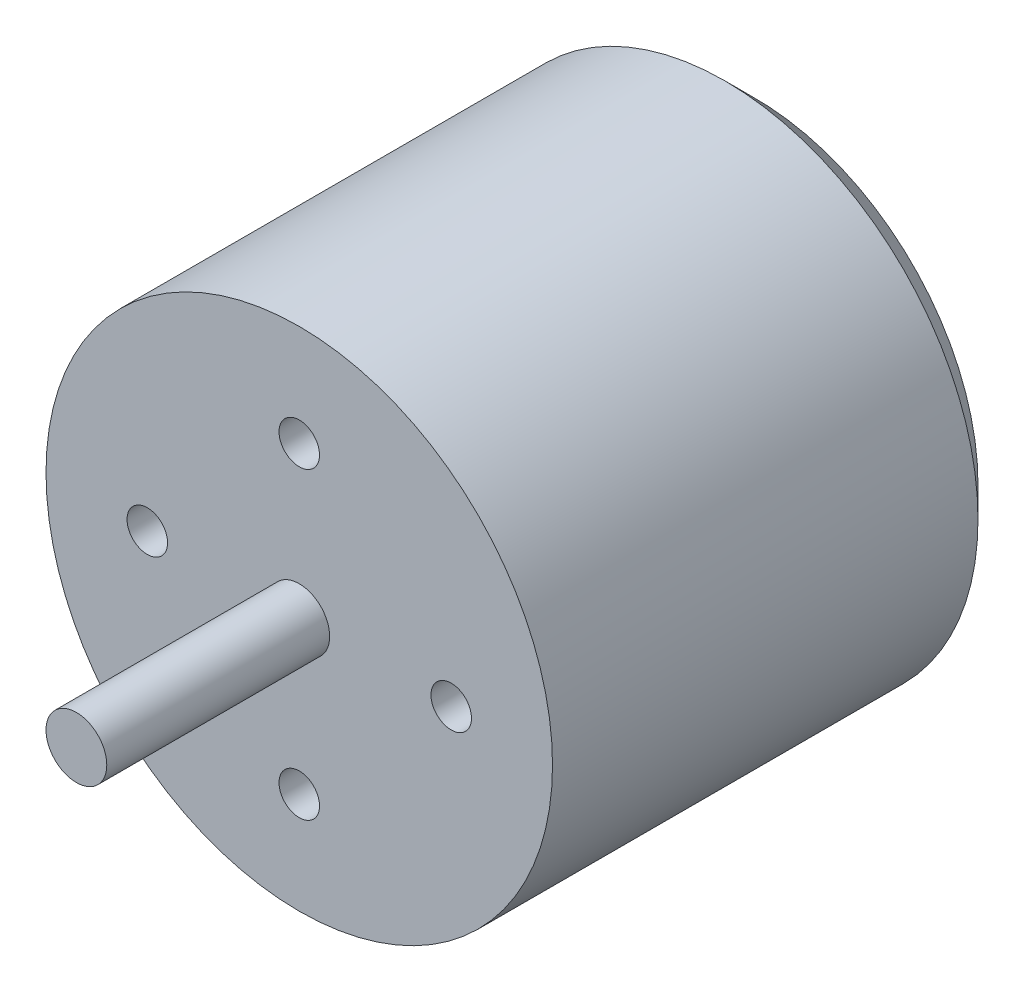
from build123d import *

# Parameters (mm, degrees)
SKETCH1_R           = 25
BOSS_EXTRUDE1_DEPTH = 45
SKETCH2_R           = 2
CUT_EXTRUDE1_DEPTH  = 10
SKETCH3_R           = 3
BOSS_EXTRUDE2_DEPTH = 22
SKETCH4_R           = 1.5
CUT_EXTRUDE2_DEPTH  = 10
BOSS_EXTRUDE3_START = 2
SKETCH5_R           = 3
BOSS_EXTRUDE3_DEPTH = 2
CHAMFER1_SIZE       = 3


with BuildPart() as part:
    # Sketch1 → Boss-Extrude1 (new body)
    with BuildSketch(Plane.XY):
        with Locations(Location((0, 0, 0), (0, 0, 180))):
            Circle(SKETCH1_R)
    extrude(amount=BOSS_EXTRUDE1_DEPTH)

    # Sketch2 → Cut-Extrude1 (cut)
    with BuildSketch(Plane.XY.offset(45)):
        with Locations((0, 15)):
            Circle(SKETCH2_R)
        with Locations(Location((0, -15, 0), (0, 0, 180))):
            Circle(SKETCH2_R)
        with Locations((-15, 0)):
            Circle(SKETCH2_R)
        with Locations(Location((15, 0, 0), (0, 0, 180))):
            Circle(SKETCH2_R)
    extrude(amount=-CUT_EXTRUDE1_DEPTH, mode=Mode.SUBTRACT)

    # Sketch3 → Boss-Extrude2 (add)
    with BuildSketch(Plane.XY.offset(45)):
        Circle(SKETCH3_R)
    extrude(amount=BOSS_EXTRUDE2_DEPTH)

    # Sketch4 → Cut-Extrude2 (cut)
    with BuildSketch(Plane(origin=(0, 0, 0), x_dir=(-1, 0, 0), z_dir=(0, 0, -1))):
        with Locations((0, 10)):
            Circle(SKETCH4_R)
        with Locations(Location((0, -10, 0), (0, 0, 180))):
            Circle(SKETCH4_R)
        with Locations((-10, 0)):
            Circle(SKETCH4_R)
        with Locations(Location((10, 0, 0), (0, 0, 180))):
            Circle(SKETCH4_R)
    extrude(amount=-CUT_EXTRUDE2_DEPTH, mode=Mode.SUBTRACT)

    # Sketch5 → Boss-Extrude3 (add)
    with BuildSketch(Plane(origin=(0, 0, 0), x_dir=(-1, 0, 0), z_dir=(0, 0, -1)).offset(BOSS_EXTRUDE3_START)):
        with Locations(Location((0, 0, 0), (0, 0, 180))):
            Circle(SKETCH5_R)
    extrude(amount=-BOSS_EXTRUDE3_DEPTH)

    # Chamfer1
    chamfer1_edges = [part.edges().sort_by_distance(p)[0] for p in [
        (25, 0, 0),
    ]]
    chamfer(chamfer1_edges, length=CHAMFER1_SIZE)


solid = part.part
